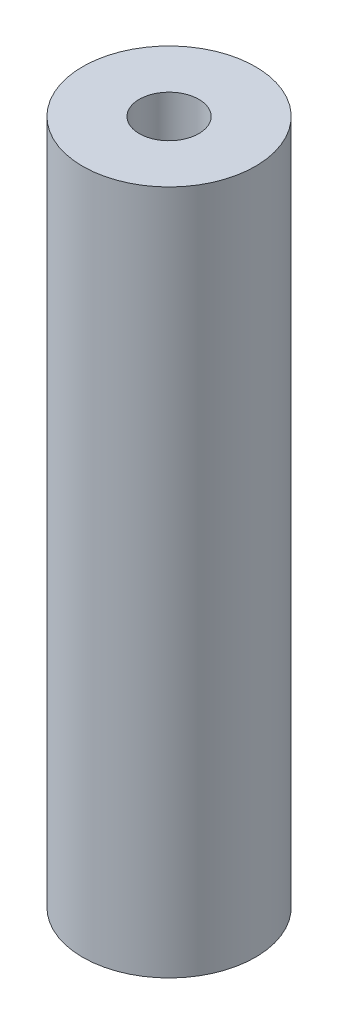
from build123d import *

# Parameters (mm, degrees)
SKETCH1_R           = 36.83
SKETCH1_R_2         = 12.7
BOSS_EXTRUDE1_DEPTH = 292.1


with BuildPart() as part:
    # Sketch1 → Boss-Extrude1 (new body)
    with BuildSketch(Plane(origin=(0, 0, 0), x_dir=(1, 0, 0), z_dir=(0, 1, 0))):
        with Locations(Location((0, 0, 0), (0, 0, 270))):
            Circle(SKETCH1_R)
        with Locations(Location((0, 0, 0), (0, 0, 270))):
            Circle(SKETCH1_R_2, mode=Mode.SUBTRACT)
    extrude(amount=BOSS_EXTRUDE1_DEPTH)


solid = part.part
